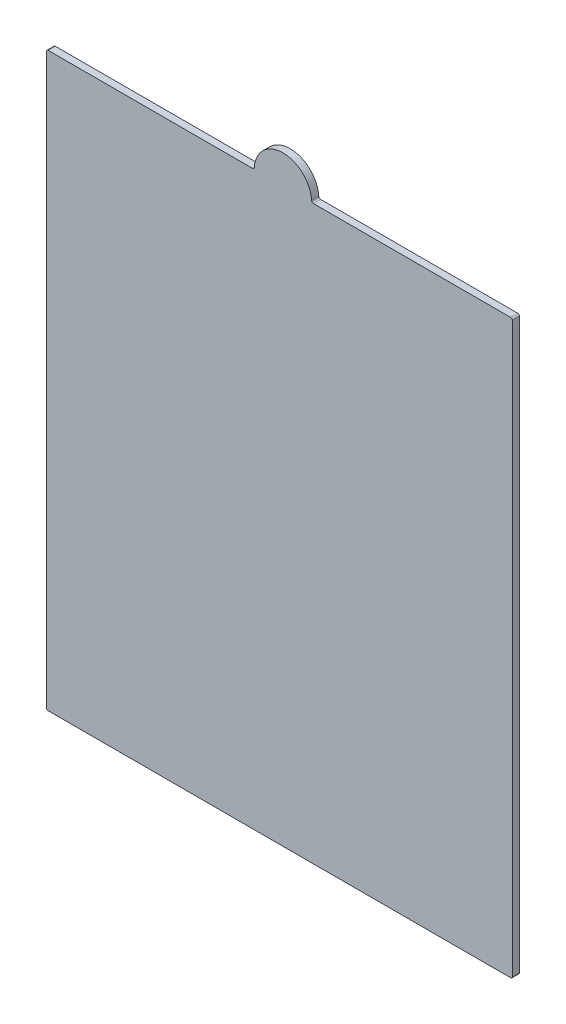
from build123d import *

# Parameters (mm, degrees)
SKETCH1_W           = 206.253
SKETCH1_H           = 253.103
BOSS_EXTRUDE1_DEPTH = 3.175
BOSS_EXTRUDE3_DEPTH = 3.175
FILLET1_R           = 0.79375


with BuildPart() as part:
    # Sketch1 → Boss-Extrude1 (new body)
    with BuildSketch(Plane.XY):
        with Locations((103.1265, 126.5515)):
            Rectangle(SKETCH1_W, SKETCH1_H)
    extrude(amount=BOSS_EXTRUDE1_DEPTH)

    # Sketch3 → Boss-Extrude3 (add)
    with BuildSketch(Plane.XY):
        with BuildLine():
            Line((92.003931261, 253.103), (117.403931261, 253.103))
            ThreePointArc((117.403931261, 253.103), (104.703931261, 265.803), (92.003931261, 253.103))
        make_face()
    extrude(amount=BOSS_EXTRUDE3_DEPTH)

    # Fillet1
    fillet1_edges = [part.edges().sort_by_distance(p)[0] for p in [
        (117.403931261, 253.103, 1.5875),
        (92.003931261, 253.103, 1.5875),
        (0, 253.103, 1.5875),
        (206.253, 253.103, 1.5875),
        (206.253, 0, 1.5875),
        (0, 0, 1.5875),
    ]]
    fillet(fillet1_edges, radius=FILLET1_R)


solid = part.part
